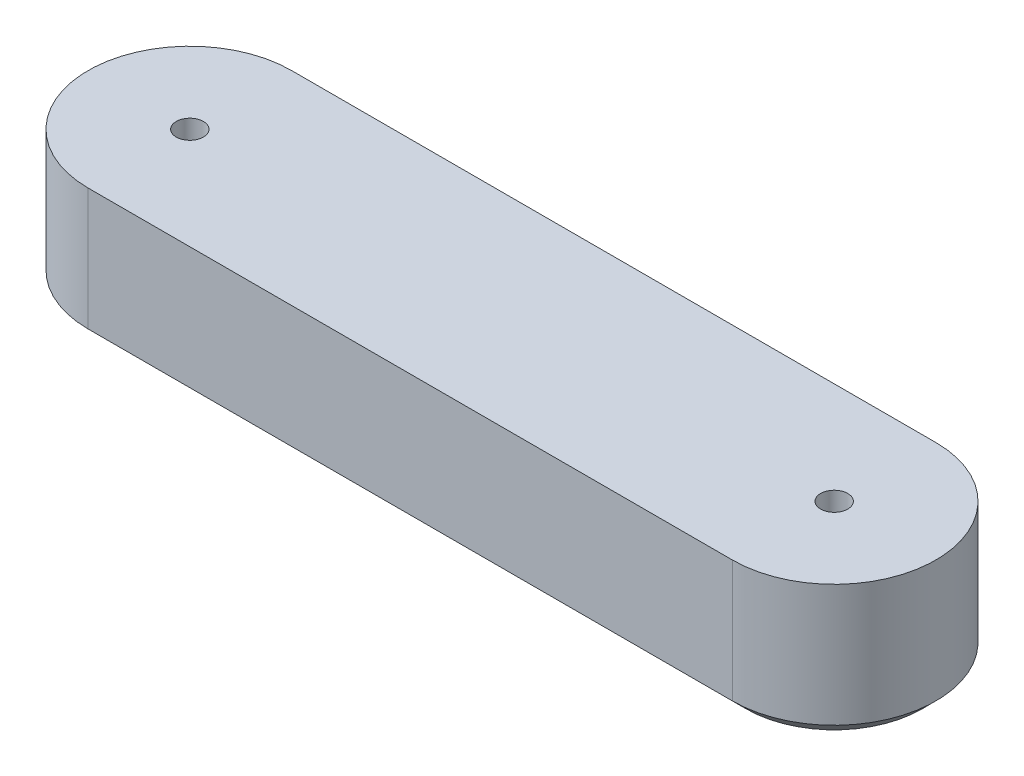
from build123d import *

# Parameters (mm, degrees)
EXTRUDE_1_DEPTH     = 20
SKETCH_3_R          = 2
CUT_EXTRUDE_1_DEPTH = 3
CHAMFER_1_SIZE      = 2


with BuildPart() as part:
    # 草图1 → 凸台-拉伸1 (new body)
    with BuildSketch(Plane(origin=(0, 0, 0), x_dir=(1, 0, 0), z_dir=(0, 1, 0))):
        with BuildLine():
            Line((0, 15), (95, 15))
            ThreePointArc((95, 15), (110, 0), (95, -15))
            Line((95, -15), (0, -15))
            ThreePointArc((0, -15), (-15, 0), (0, 15))
        make_face()
    extrude(amount=EXTRUDE_1_DEPTH)

    # 草图3 → 切除-拉伸1 (cut)
    with BuildSketch(Plane(origin=(0, 20, 0), x_dir=(1, 0, 0), z_dir=(0, 1, 0))):
        with Locations(Location((0, 0, 0), (0, 0, 270))):
            Circle(SKETCH_3_R)
        with Locations(Location((95, 0, 0), (0, 0, 270))):
            Circle(SKETCH_3_R)
    extrude(amount=-CUT_EXTRUDE_1_DEPTH, mode=Mode.SUBTRACT)

    # 倒角1
    chamfer_1_edges = [part.edges().sort_by_distance(p)[0] for p in [
        (47.5, 0, -15),
        (110, 0, 0),
        (47.5, 0, 15),
        (-15, 0, 0),
    ]]
    chamfer(chamfer_1_edges, length=CHAMFER_1_SIZE)


solid = part.part
